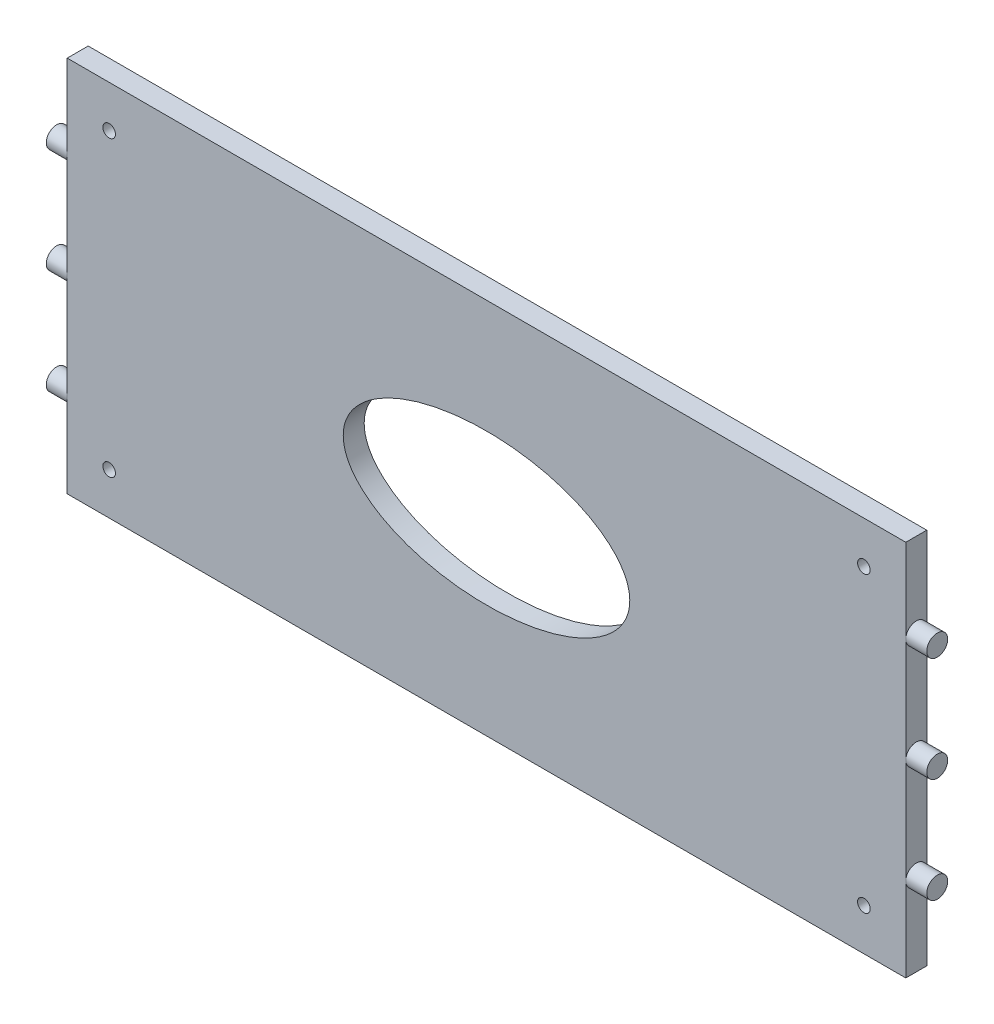
from build123d import *

# Parameters (mm, degrees)
SKETCH1_W           = 200
SKETCH1_H           = 90
BOSS_EXTRUDE1_DEPTH = 5
SKETCH2_R           = 2.5
BOSS_EXTRUDE2_DEPTH = 5
SKETCH3_R           = 1.5
SKETCH3_RX          = 34.171351791
SKETCH3_RY          = 17.990877267
CUT_EXTRUDE1_DEPTH  = 5


with BuildPart() as part:
    # Sketch1 → Boss-Extrude1 (new body)
    with BuildSketch(Plane.XY):
        Rectangle(SKETCH1_W, SKETCH1_H)
    extrude(amount=BOSS_EXTRUDE1_DEPTH)

    # Sketch2 → Boss-Extrude2 (add)
    with BuildSketch(Plane(origin=(100, 0, 0), x_dir=(0, 0, -1), z_dir=(1, 0, 0))):
        with Locations((-2.5, 25)):
            Circle(SKETCH2_R)
        with Locations((-2.5, 0)):
            Circle(SKETCH2_R)
        with Locations((-2.5, -25)):
            Circle(SKETCH2_R)
    boss_extrude2 = extrude(amount=BOSS_EXTRUDE2_DEPTH)

    # Mirror1: Boss-Extrude2 across plane
    add(boss_extrude2.mirror(Plane(origin=(0, 0, 0), x_dir=(0, 0, 1), z_dir=(1, 0, 0))))

    # Sketch3 → Cut-Extrude1 (cut)
    with BuildSketch(Plane(origin=(0, 0, 0), x_dir=(-1, 0, 0), z_dir=(0, 0, -1))):
        with Locations((-90, 35)):
            Circle(SKETCH3_R)
        with Locations(Location((-90, -35, 0), (0, 0, 180))):
            Circle(SKETCH3_R)
        with Locations((90, -35)):
            Circle(SKETCH3_R)
        with Locations(Location((90, 35, 0), (0, 0, 180))):
            Circle(SKETCH3_R)
        with Locations((0, 0)):
            Ellipse(SKETCH3_RX, SKETCH3_RY)
    extrude(amount=-CUT_EXTRUDE1_DEPTH, mode=Mode.SUBTRACT)


solid = part.part
